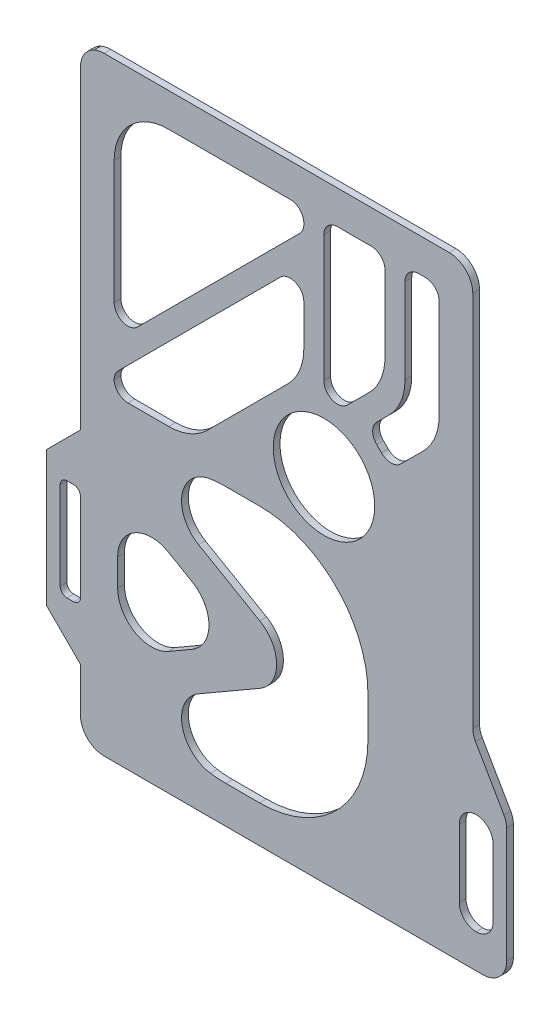
from build123d import *

# Parameters (mm, degrees)
SKETCH_1_R          = 7.5
EXTRUDE_1_DEPTH     = 1
FILLET_1_R          = 3
FILLET_2_R          = 3.5
CUT_EXTRUDE_1_DEPTH = 10
EXTRUDE_2_DEPTH     = 1
FILLET_3_R          = 5


with BuildPart() as part:
    # 草图1 → 凸台-拉伸1 (new body)
    with BuildSketch(Plane.XY):
        with BuildLine():
            Line((-34, 37.637190605), (-34, 37.66227766))
            ThreePointArc((-34, 37.66227766), (-35.458039892, 36.370828693), (-36, 34.5))
            Line((-36, 34.5), (-36, -12))
            Line((-36, -12), (-41, -17))
            Line((-41, -17), (-41, -37))
            Line((-41, -37), (-36, -42))
            Line((-36, -42), (-36, -48.5))
            ThreePointArc((-36, -48.5), (-34.974873734, -50.974873734), (-32.5, -52))
            Line((-32.5, -52), (-3, -52))
            Line((-3, -52), (27, -52))
            Line((27, -52), (27, -30.660254038))
            Line((27, -30.660254038), (22, -22))
            Line((22, -22), (22, -2))
            Line((22, -2), (22, 37.977350269))
            Line((22, 37.977350269), (-32.5, 37.977350269))
            ThreePointArc((-32.5, 37.977350269), (-33.269043009, 37.891244277), (-34, 37.637190605))
        make_face()
        Circle(SKETCH_1_R, mode=Mode.SUBTRACT)
        with BuildLine():
            Line((-38, -34.5), (-37, -34.5))
            ThreePointArc((-37, -34.5), (-36.292893219, -34.207106781), (-36, -33.5))
            Line((-36, -33.5), (-36, -20.5))
            ThreePointArc((-36, -20.5), (-36.292893219, -19.792893219), (-37, -19.5))
            Line((-37, -19.5), (-38, -19.5))
            ThreePointArc((-38, -19.5), (-38.707106781, -19.792893219), (-39, -20.5))
            Line((-39, -20.5), (-39, -33.5))
            ThreePointArc((-39, -33.5), (-38.707106781, -34.207106781), (-38, -34.5))
        make_face(mode=Mode.SUBTRACT)
        with BuildLine():
            Line((-14.5, -46.5), (-9.5, -46.5))
            ThreePointArc((-9.5, -46.5), (1.813708499, -41.813708499), (6.5, -30.5))
            Line((6.5, -30.5), (6.5, -24.5))
            ThreePointArc((6.5, -24.5), (1.813708499, -13.186291501), (-9.5, -8.5))
            Line((-9.5, -8.5), (-14.5, -8.5))
            ThreePointArc((-14.5, -8.5), (-25.813708499, -13.186291501), (-30.5, -24.5))
            Line((-30.5, -24.5), (-30.5, -30.5))
            ThreePointArc((-30.5, -30.5), (-25.813708499, -41.813708499), (-14.5, -46.5))
        make_face(mode=Mode.SUBTRACT)
        with BuildLine():
            Line((11.977350269, 31), (11.977350269, 18.384776311))
            ThreePointArc((11.977350269, 18.384776311), (11.370110637, 15.331976529), (9.640838471, 12.74393784))
            Line((9.640838471, 12.74393784), (7.791596066, 10.894695435))
            ThreePointArc((7.791596066, 10.894695435), (7.199175676, 9.464466094), (7.791596066, 8.034236753))
            Line((7.791596066, 8.034236753), (8.498702848, 7.327129972))
            ThreePointArc((8.498702848, 7.327129972), (9.928932188, 6.734709582), (11.359161529, 7.327129972))
            Line((11.359161529, 7.327129972), (14.672870028, 10.640838471))
            ThreePointArc((14.672870028, 10.640838471), (16.411961883, 13.243573363), (17.022649731, 16.313708499))
            Line((17.022649731, 16.313708499), (17.022649731, 31))
            ThreePointArc((17.022649731, 31), (16.430229341, 32.430229341), (15, 33.022649731))
            Line((15, 33.022649731), (14, 33.022649731))
            ThreePointArc((14, 33.022649731), (12.569770659, 32.430229341), (11.977350269, 31))
        make_face(mode=Mode.SUBTRACT)
        with BuildLine():
            Line((7, 33.022649731), (2, 33.022649731))
            ThreePointArc((2, 33.022649731), (0.569770659, 32.430229341), (-0.022649731, 31))
            Line((-0.022649731, 31), (-0.022649731, 12.328427125))
            ThreePointArc((-0.022649731, 12.328427125), (1.225965459, 10.459742437), (3.430229341, 10.898197784))
            Line((3.430229341, 10.898197784), (6.672870028, 14.140838471))
            ThreePointArc((6.672870028, 14.140838471), (8.411961883, 16.743573363), (9.022649731, 19.813708499))
            Line((9.022649731, 19.813708499), (9.022649731, 31))
            ThreePointArc((9.022649731, 31), (8.430229341, 32.430229341), (7, 33.022649731))
        make_face(mode=Mode.SUBTRACT)
        with BuildLine():
            Line((-6.430229341, 22.359161529), (-30.430229341, -1.640838471))
            ThreePointArc((-30.430229341, -1.640838471), (-30.861813207, -2.280647977), (-31.022337577, -3.035533906))
            ThreePointArc((-31.022337577, -3.035533906), (-30.41761054, -4.442737776), (-29, -5.022649731))
            Line((-29, -5.022649731), (-22.928932188, -5.022649731))
            ThreePointArc((-22.928932188, -5.022649731), (-19.858797052, -4.411961883), (-17.25606216, -2.672870028))
            Line((-17.25606216, -2.672870028), (-5.327129972, 9.25606216))
            ThreePointArc((-5.327129972, 9.25606216), (-3.588038117, 11.858797052), (-2.977350269, 14.928932188))
            Line((-2.977350269, 14.928932188), (-2.977350269, 20.928932188))
            ThreePointArc((-2.977350269, 20.928932188), (-4.225965459, 22.797616876), (-6.430229341, 22.359161529))
        make_face(mode=Mode.SUBTRACT)
        with BuildLine():
            Line((-27.569770659, 5.398197784), (-3.569770659, 29.398197784))
            ThreePointArc((-3.569770659, 29.398197784), (-3.131315312, 30.054392583), (-2.977350269, 30.828427125))
            Line((-2.977350269, 30.828427125), (-2.977350269, 31))
            ThreePointArc((-2.977350269, 31), (-3.569770659, 32.430229341), (-5, 33.022649731))
            Line((-5, 33.022649731), (-23, 33.022649731))
            ThreePointArc((-23, 33.022649731), (-28.672870028, 30.672870028), (-31.022649731, 25))
            Line((-31.022649731, 25), (-31.022649731, 6.828427125))
            ThreePointArc((-31.022649731, 6.828427125), (-29.774034541, 4.959742437), (-27.569770659, 5.398197784))
        make_face(mode=Mode.SUBTRACT)
    extrude(amount=EXTRUDE_1_DEPTH)

    # 圆角1
    fillet_1_edges = [part.edges().sort_by_distance(p)[0] for p in [
        (22, -22, 0.5),
        (27, -30.660254038, 0.5),
    ]]
    fillet(fillet_1_edges, radius=FILLET_1_R)

    # 圆角2
    fillet_2_edges = [part.edges().sort_by_distance(p)[0] for p in [
        (22, 37.977350269, 0.5),
        (27, -52, 0.5),
    ]]
    fillet(fillet_2_edges, radius=FILLET_2_R)

    # 草图2 → 切除-拉伸1 (cut)
    with BuildSketch(Plane(origin=(0, 0, 0), x_dir=(-1, 0, 0), z_dir=(0, 0, -1))):
        with BuildLine():
            Line((-22.51, -47), (-22.49, -47))
            ThreePointArc((-22.49, -47), (-20.729304115, -46.270695885), (-20, -44.51))
            Line((-20, -44.51), (-20, -34.49))
            ThreePointArc((-20, -34.49), (-20.729304115, -32.729304115), (-22.49, -32))
            Line((-22.49, -32), (-22.51, -32))
            ThreePointArc((-22.51, -32), (-24.270695885, -32.729304115), (-25, -34.49))
            Line((-25, -34.49), (-25, -44.51))
            ThreePointArc((-25, -44.51), (-24.270695885, -46.270695885), (-22.51, -47))
        make_face()
    extrude(amount=-CUT_EXTRUDE_1_DEPTH, mode=Mode.SUBTRACT)

    # 草图3 → 凸台-拉伸2 (add)
    with BuildSketch(Plane(origin=(0, 0, 0), x_dir=(-1, 0, 0), z_dir=(0, 0, -1))):
        with BuildLine():
            Line((12, -27.5), (29.320508076, -17.5))
            ThreePointArc((29.320508076, -17.5), (30.076804592, -18.942597605), (30.713203436, -20.441953728))
            Line((30.713203436, -20.441953728), (30.713203436, -10.922424267))
            Line((30.713203436, -10.922424267), (2, -27.5))
            Line((2, -27.5), (30.713203436, -44.077575733))
            Line((30.713203436, -44.077575733), (30.713203436, -34.558046272))
            ThreePointArc((30.713203436, -34.558046272), (30.076804592, -36.057402395), (29.320508076, -37.5))
            Line((29.320508076, -37.5), (12, -27.5))
        make_face()
    extrude(amount=-EXTRUDE_2_DEPTH)

    # 圆角3
    fillet_3_edges = [part.edges().sort_by_distance(p)[0] for p in [
        (-26.164686329, -41.451488157, 0.5),
        (-28.98117459, -37.304085721, 0.5),
        (-28.98117459, -17.695914279, 0.5),
        (-26.164686329, -13.548511843, 0.5),
        (-12, -27.5, 0.5),
        (-2, -27.5, 0.5),
    ]]
    fillet(fillet_3_edges, radius=FILLET_3_R)


solid = part.part
